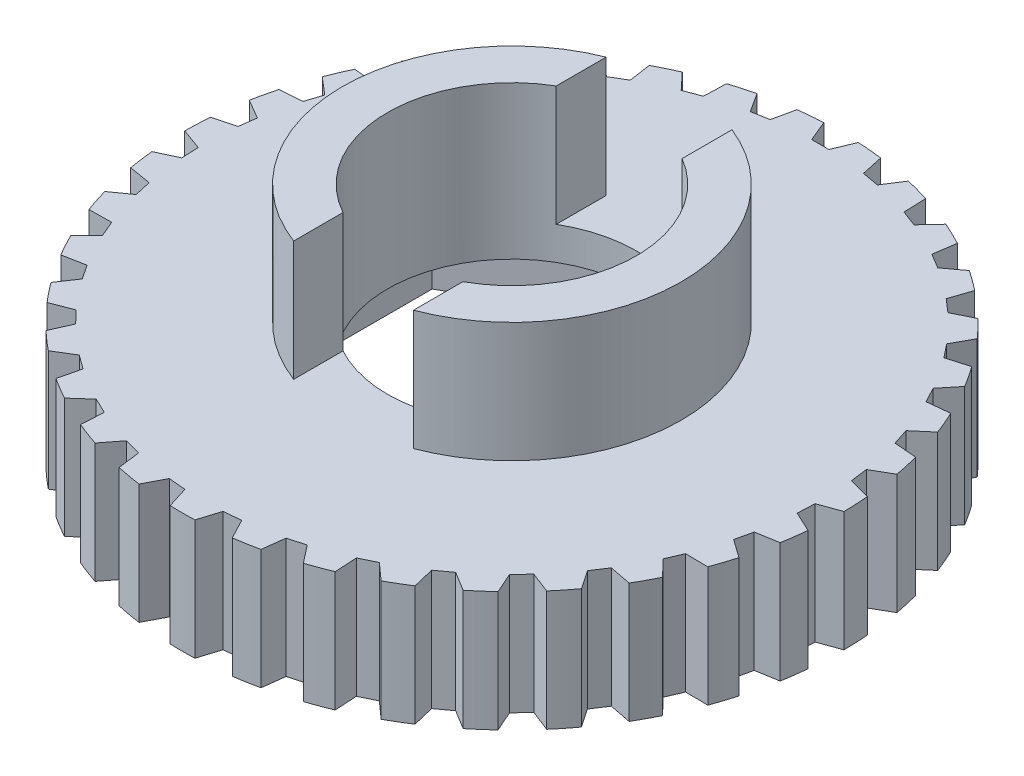
from build123d import *

# Parameters (mm, degrees)
SKETCH_1_R               = 5.65
SKETCH_1_R_2             = 4.15
EXTRUDE_1_DEPTH          = 8
SKETCH_1_3_R             = 11
SKETCH_1_3_R_2           = 5.65
EXTRUDE_2_DEPTH          = 4
CUT_EXTRUDE_1_DEPTH      = 2.9
CUT_EXTRUDE_START        = -4
CUT_EXTRUDE_3_DEPTH      = 4
CUT_EXTRUDE_START_2      = -10
CUT_EXTRUDE_4_DEPTH      = 10
PATTERN_CIRCULAR_1_COUNT = 35


with BuildPart() as part:
    # 草图1 → 凸台-拉伸1 (new body)
    with BuildSketch(Plane(origin=(0, 0, 0), x_dir=(1, 0, 0), z_dir=(0, 1, 0))):
        with Locations(Location((0, 0, 0), (0, 0, 270))):
            Circle(SKETCH_1_R)
        with Locations(Location((0, 0, 0), (0, 0, 270))):
            Circle(SKETCH_1_R_2, mode=Mode.SUBTRACT)
    extrude(amount=EXTRUDE_1_DEPTH)

    # 草图1<3> → 凸台-拉伸2 (add)
    with BuildSketch(Plane(origin=(0, 0, 0), x_dir=(1, 0, 0), z_dir=(0, 1, 0))):
        with Locations(Location((0, 0, 0), (0, 0, 270))):
            Circle(SKETCH_1_3_R)
        with Locations(Location((0, 0, 0), (0, 0, 270))):
            Circle(SKETCH_1_3_R_2, mode=Mode.SUBTRACT)
    extrude(amount=EXTRUDE_2_DEPTH)

    # 草图2 → 切除-拉伸1 (cut)
    with BuildSketch(Plane.XZ):
        Polygon((0, -7.274613392), (-6.3, -3.637306696), (-6.3, 3.637306696), (0, 7.274613392), (6.3, 3.637306696), (6.3, -3.637306696), align=None)
    extrude(amount=-CUT_EXTRUDE_1_DEPTH, mode=Mode.SUBTRACT)

    # 草图4 → 切除-拉伸3 (cut)
    with BuildSketch(Plane(origin=(0, 8, 0), x_dir=(1, 0, 0), z_dir=(0, 1, 0)).offset(CUT_EXTRUDE_START)):
        with BuildLine():
            Line((-2.1, 5.245235934), (-2.1, 3.579455266))
            ThreePointArc((-2.1, 3.579455266), (0, 4.15), (2.1, 3.579455266))
            Line((2.1, 3.579455266), (2.1, 5.245235934))
            ThreePointArc((2.1, 5.245235934), (0, 5.65), (-2.1, 5.245235934))
        make_face()
        with BuildLine():
            Line((2, -3.636275567), (2, -5.284174486))
            ThreePointArc((2, -5.284174486), (0, -5.65), (-2, -5.284174486))
            Line((-2, -5.284174486), (-2, -3.636275567))
            ThreePointArc((-2, -3.636275567), (0, -4.15), (2, -3.636275567))
        make_face()
    extrude(amount=CUT_EXTRUDE_3_DEPTH, mode=Mode.SUBTRACT)

    # 草图5 → 切除-拉伸4 (cut)
    with BuildSketch(Plane(origin=(0, 4, 0), x_dir=(1, 0, 0), z_dir=(0, 1, 0)).offset(CUT_EXTRUDE_START_2)):
        with BuildLine():
            ThreePointArc((0.574025149, 10.985012295), (0, 11), (-0.574025149, 10.985012295))
            Line((-0.574025149, 10.985012295), (-0.287012574, 10.292102646))
            Line((-0.287012574, 10.292102646), (0.287012574, 10.292102646))
            Line((0.287012574, 10.292102646), (0.574025149, 10.985012295))
        make_face()
    cut_extrude_4 = extrude(amount=CUT_EXTRUDE_4_DEPTH, mode=Mode.SUBTRACT)

    # 阵列(圆周)1: 切除-拉伸4 ×35 about axis
    pattern_circular_1_axis = Axis((0, 0, 0), (0, 1, 0))
    for i in range(1, PATTERN_CIRCULAR_1_COUNT):
        add(cut_extrude_4.rotate(pattern_circular_1_axis, i * 360 / PATTERN_CIRCULAR_1_COUNT), mode=Mode.SUBTRACT)


solid = part.part
